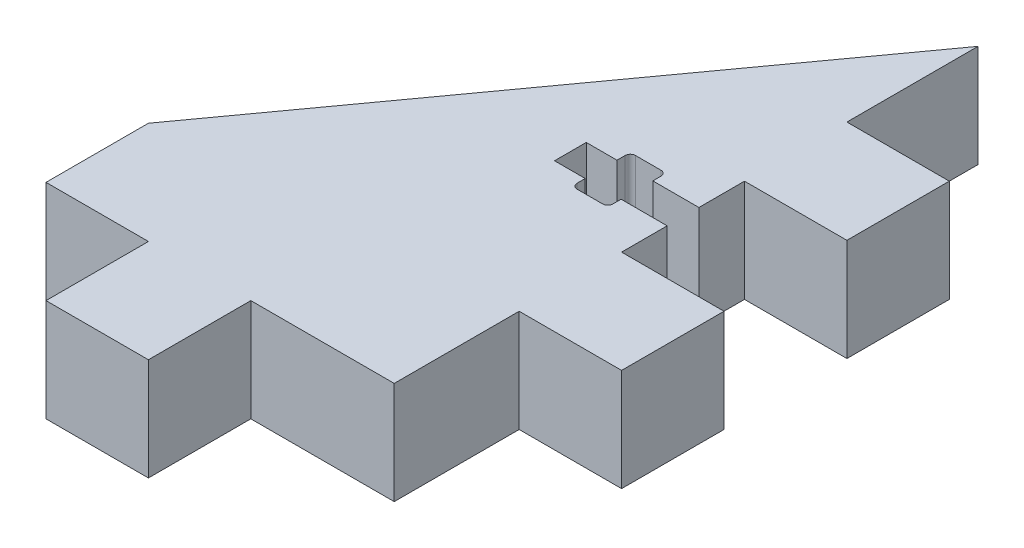
from build123d import *

# Parameters (mm, degrees)
BOSS_EXTRUDE1_DEPTH = 10
CUT_EXTRUDE1_DEPTH  = 68.119296778


with BuildPart() as part:
    # Sketch1 → Boss-Extrude1 (new body)
    with BuildSketch(Plane(origin=(0, 0, 0), x_dir=(1, 0, 0), z_dir=(0, 1, 0))):
        Polygon((0, 0), (-14, 0), (-14, -10), (-24, -10), (-24, 0), (-34, 0), (-34, 10), (0, 57), (0, 44.2), (10, 44.2), (10, 34.2), (0, 34.2), (0, 22.2), (10, 22.2), (10, 12.2), (0, 12.2), align=None)
    extrude(amount=BOSS_EXTRUDE1_DEPTH)

    # Sketch3 → Cut-Extrude1 (cut, through all)
    with BuildSketch(Plane(origin=(0, 10, 0), x_dir=(1, 0, 0), z_dir=(0, 1, 0))):
        with BuildLine():
            Line((-11, 29.75), (-8, 29.75))
            Line((-8, 29.75), (-8, 30.55))
            ThreePointArc((-8, 30.55), (-7.853553391, 30.903553391), (-7.5, 31.05))
            Line((-7.5, 31.05), (-5, 31.05))
            ThreePointArc((-5, 31.05), (-4.646446609, 30.903553391), (-4.5, 30.55))
            Line((-4.5, 30.55), (-4.5, 29.75))
            Line((-4.5, 29.75), (0, 29.75))
            Line((0, 29.75), (0, 26.65))
            Line((0, 26.65), (-4.5, 26.65))
            Line((-4.5, 26.65), (-4.5, 25.85))
            ThreePointArc((-4.5, 25.85), (-4.646446609, 25.496446609), (-5, 25.35))
            Line((-5, 25.35), (-7.5, 25.35))
            ThreePointArc((-7.5, 25.35), (-7.853553391, 25.496446609), (-8, 25.85))
            Line((-8, 25.85), (-8, 26.65))
            Line((-8, 26.65), (-11, 26.65))
            Line((-11, 26.65), (-11, 29.75))
        make_face()
    extrude(amount=-CUT_EXTRUDE1_DEPTH, mode=Mode.SUBTRACT)


solid = part.part
